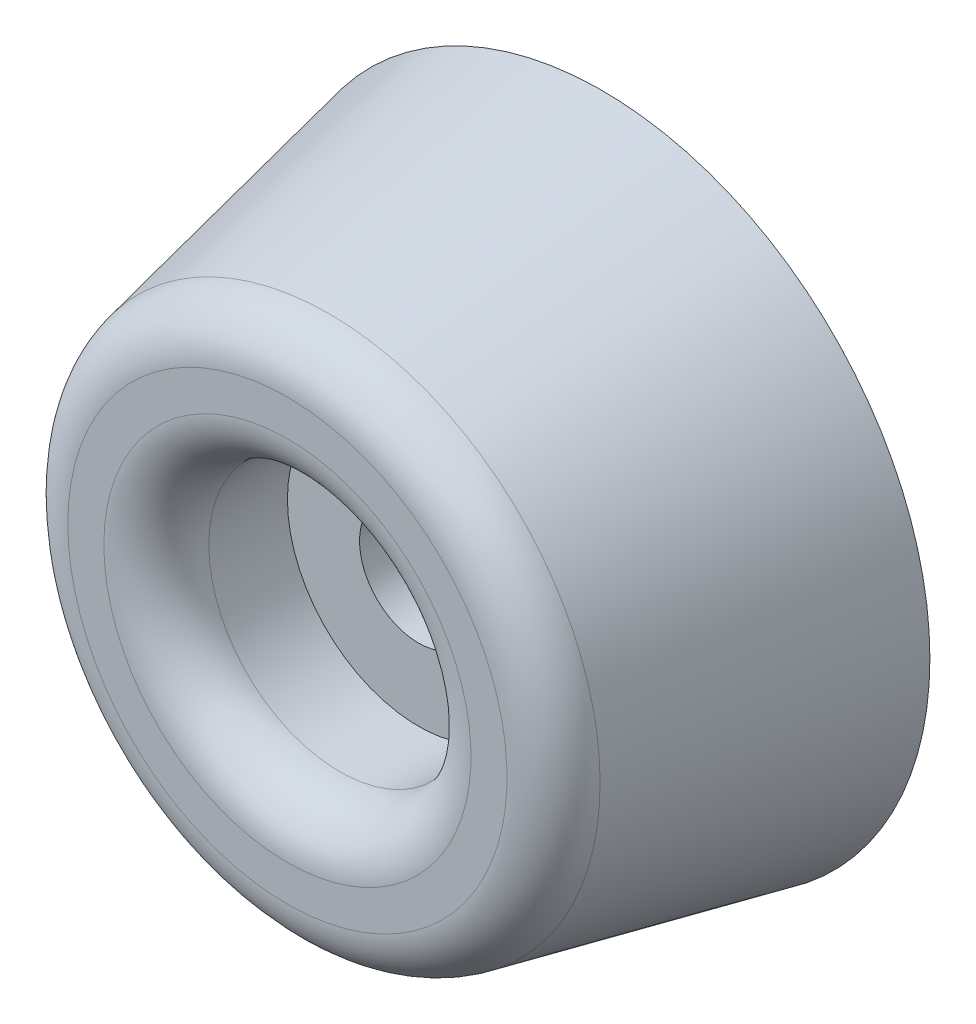
from build123d import *

# Parameters (mm, degrees)
ENL_V_MAT_EXTRU_1_REACH = 23.366
ESQUISSE2_R             = 2.25
ESQUISSE3_R             = 5
ENL_V_MAT_EXTRU_2_DEPTH = 5
CONG_1_R                = 2


with BuildPart() as part:
    # Esquisse1 → Révolution1 (revolve)
    with BuildSketch(Plane(origin=(0, 0, 0), x_dir=(0, 0, -1), z_dir=(1, 0, 0)), mode=Mode.PRIVATE) as r_volution1_sk:
        Polygon((0, 0), (12, 0), (12, 12.5), (0, 10), align=None)
    revolve(r_volution1_sk.sketch.rotate(Axis((0, 0, 0), (0, 0, -1)), 90), axis=Axis((0, 0, 0), (0, 0, -1)))

    # Esquisse2 → Enlèv. mat.-Extru.1 (cut, up to next)
    with BuildSketch(Plane.XY, mode=Mode.PRIVATE) as enl_v_mat_extru_1_sk1:
        Circle(ESQUISSE2_R)
    enl_v_mat_extru_1_tool1 = extrude(enl_v_mat_extru_1_sk1.sketch, amount=-ENL_V_MAT_EXTRU_1_REACH, mode=Mode.PRIVATE) & part.part
    add(enl_v_mat_extru_1_tool1.solids().sort_by_distance((0, 0, 0))[0], mode=Mode.SUBTRACT)

    # Esquisse3 → Enlèv. mat.-Extru.2 (cut)
    with BuildSketch(Plane.XY):
        Circle(ESQUISSE3_R)
    extrude(amount=-ENL_V_MAT_EXTRU_2_DEPTH, mode=Mode.SUBTRACT)

    # Congé1
    cong_1_edges = [part.edges().sort_by_distance(p)[0] for p in [
        (-5, 0, 0),
        (-10, 0, 0),
    ]]
    fillet(cong_1_edges, radius=CONG_1_R)


solid = part.part
